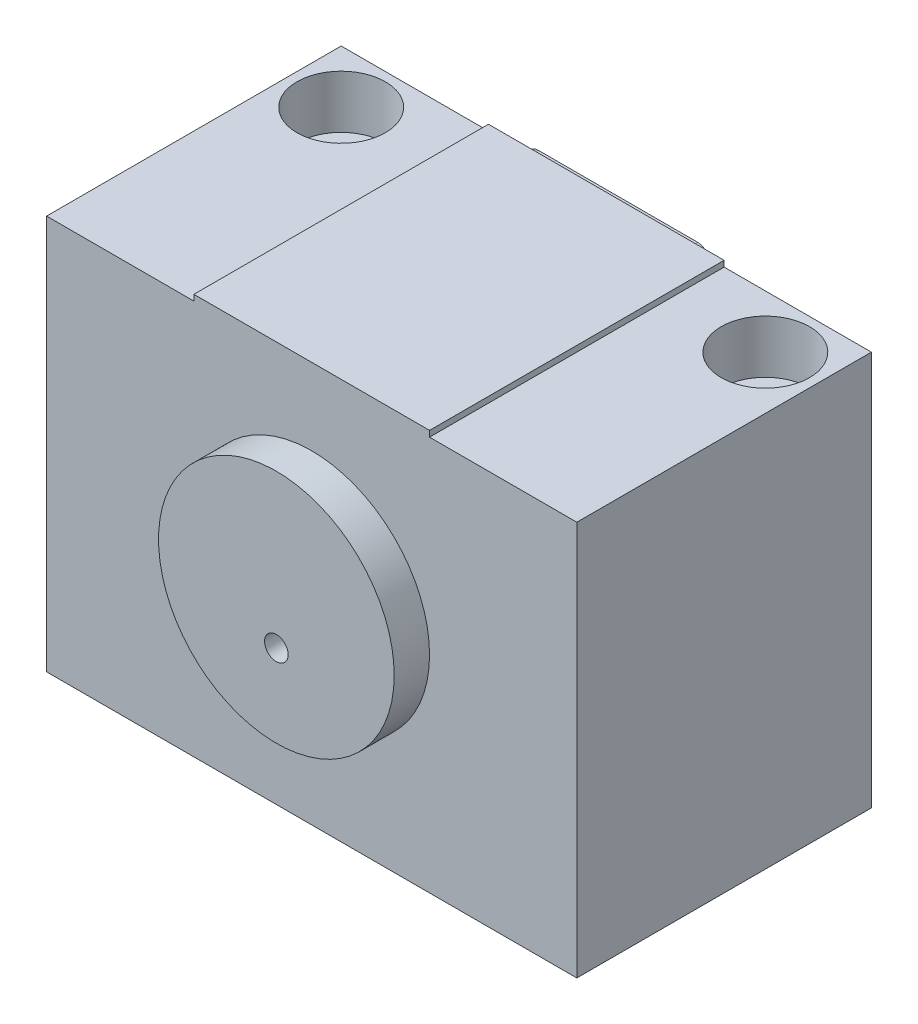
from build123d import *

# Parameters (mm, degrees)
SKETCH1_W                     = 45
SKETCH1_H                     = 33.5
BASE_EXTRUDE_DEPTH            = 25
SKETCH2_W                     = 20
SKETCH2_H                     = 0.5
TOPBOSS_DEPTH                 = 25
SKETCH3_R                     = 10
INSERT_DEPTH                  = 3
SKETCH5_R                     = 3.75
TOPCBORES_DEPTH               = 4.5
SKETCH6_R                     = 2.25
TOPTHRUHOLES_DEPTH            = 47.165463282
PORTTHRUHOLETOP_DEPTH         = 40.956226048
PORTTHRUHOLETOP_DEPTH_BACK    = 40.956226048
SKETCH18_R                    = 1
SKETCH24_R                    = 1
PORTTHRUHOLEBOTTOM_DEPTH      = 56.814424659
SKETCH25_R                    = 2.5
SIDEACBORETOP_DEPTH           = 5
SIDEBCBORETOP_START           = -5
SKETCH26_R                    = 2.5
SIDEBCBORETOP_DEPTH           = 5
SKETCH28_R                    = 2.5
SIDEACBOREBOTTOM_DEPTH        = 5
SIDEBCBOREBOTTOM_START        = -5
SKETCH29_R                    = 2.5
SIDEBCBOREBOTTOM_DEPTH        = 5
SKETCH19_R                    = 2.5
CVALVECUT2_DEPTH              = 2
SKETCH30_R                    = 2
CVALVE2_DEPTH                 = 2
SKETCH20_R                    = 2.5
EXTRUDE_1_DEPTH               = 4
SKETCH21_R                    = 2.5
EXTRUDE_2_DEPTH               = 4
SKETCH35_R                    = 2.5
CENTERENDPORTH_R_G_DEPTH      = 5
SKETCH36_R                    = 1
CENTERENDPORTH_R_G_THRU_DEPTH = 37.626493144
SKETCH37_R                    = 2.5
OFFCENTERENDPORTH_R_DEPTH     = 5
SKETCH38_R                    = 1
OFFCENTERENDPORTH_RTHRU_DEPTH = 5
PLASTICCAP_DEPTH              = 1
SKETCH40_R                    = 2.5
BOTTOMPORTS_DEPTH             = 5
SKETCH41_R                    = 1
BOTTOMAPASSAGE_DEPTH          = 22.5
SKETCH42_R                    = 1
BOTTOMBPASSAGE_DEPTH          = 11.5
SKETCH43_R                    = 3
CUT_EXTRUDE1_DEPTH            = 12


with BuildPart() as part:
    # Sketch1 → Base-Extrude (new body)
    with BuildSketch(Plane.XY):
        with Locations((0, -0.75)):
            Rectangle(SKETCH1_W, SKETCH1_H)
    extrude(amount=BASE_EXTRUDE_DEPTH)

    # Sketch2 → TopBoss (add)
    with BuildSketch(Plane.XY):
        with Locations((0, 16.25)):
            Rectangle(SKETCH2_W, SKETCH2_H)
    extrude(amount=TOPBOSS_DEPTH)

    # Sketch3 → Insert (add)
    with BuildSketch(Plane.XY.offset(25)):
        Circle(SKETCH3_R)
    extrude(amount=INSERT_DEPTH)

    # Sketch5 → TopCbores (cut)
    with BuildSketch(Plane(origin=(0, 16, 0), x_dir=(-1, 0, 0), z_dir=(0, 1, 0))):
        with Locations(Location((18, 4.5, 0), (0, 0, 90))):
            Circle(SKETCH5_R)
        with Locations(Location((-18, 4.5, 0), (0, 0, 270))):
            Circle(SKETCH5_R)
    extrude(amount=-TOPCBORES_DEPTH, mode=Mode.SUBTRACT)

    # Sketch6 → TopThruHoles (cut, through all)
    with BuildSketch(Plane(origin=(0, 11.5, 0), x_dir=(-1, 0, 0), z_dir=(0, 1, 0))):
        with Locations(Location((-18, 4.5, 0), (0, 0, 90))):
            Circle(SKETCH6_R)
        with Locations(Location((18, 4.5, 0), (0, 0, 90))):
            Circle(SKETCH6_R)
    extrude(amount=-TOPTHRUHOLES_DEPTH, mode=Mode.SUBTRACT)

    # Sketch18 → PortThruHoleTop (cut, two sides: drawn at the far end of the back side and taken through both)
    with BuildSketch(Plane(origin=(0, 0, 0), x_dir=(0, 0, -1), z_dir=(1, 0, 0)).offset(-PORTTHRUHOLETOP_DEPTH_BACK)):
        with Locations((-12.5, 5)):
            Circle(SKETCH18_R)
    extrude(amount=PORTTHRUHOLETOP_DEPTH + PORTTHRUHOLETOP_DEPTH_BACK, mode=Mode.SUBTRACT)

    # Sketch24 → PortThruHoleBottom (cut, through all)
    with BuildSketch(Plane(origin=(22.5, 0, 0), x_dir=(0, 0, -1), z_dir=(1, 0, 0))):
        with Locations(Location((-12.5, -6, 0), (0, 0, 90))):
            Circle(SKETCH24_R)
    extrude(amount=-PORTTHRUHOLEBOTTOM_DEPTH, mode=Mode.SUBTRACT)

    # Sketch25 → SideACboreTop (cut)
    with BuildSketch(Plane(origin=(22.5, 0, 0), x_dir=(0, 0, -1), z_dir=(1, 0, 0))):
        with Locations(Location((-12.5, 5, 0), (0, 0, 90))):
            Circle(SKETCH25_R)
    extrude(amount=-SIDEACBORETOP_DEPTH, mode=Mode.SUBTRACT)

    # Sketch26 → SideBCboreTop (cut)
    with BuildSketch(Plane.ZY.offset(22.5).offset(SIDEBCBORETOP_START)):
        with Locations(Location((12.5, 5, 0), (0, 0, 90))):
            Circle(SKETCH26_R)
    extrude(amount=SIDEBCBORETOP_DEPTH, mode=Mode.SUBTRACT)

    # Sketch28 → SideACboreBottom (cut)
    with BuildSketch(Plane(origin=(22.5, 0, 0), x_dir=(0, 0, -1), z_dir=(1, 0, 0))):
        with Locations(Location((-12.5, -6, 0), (0, 0, 90))):
            Circle(SKETCH28_R)
    extrude(amount=-SIDEACBOREBOTTOM_DEPTH, mode=Mode.SUBTRACT)

    # Sketch29 → SideBCboreBottom (cut)
    with BuildSketch(Plane.ZY.offset(22.5).offset(SIDEBCBOREBOTTOM_START)):
        with Locations(Location((12.5, -6, 0), (0, 0, 90))):
            Circle(SKETCH29_R)
    extrude(amount=SIDEBCBOREBOTTOM_DEPTH, mode=Mode.SUBTRACT)

    # Sketch19 → CValveCut2 (cut)
    with BuildSketch(Plane.ZY.offset(22.5)):
        with Locations(Location((17.5, 0, 0), (0, 0, 270))):
            Circle(SKETCH19_R)
    extrude(amount=-CVALVECUT2_DEPTH, mode=Mode.SUBTRACT)

    # Sketch30 → CValve2 (add)
    with BuildSketch(Plane.ZY.offset(20.5)):
        with Locations(Location((17.5, 0, 0), (0, 0, 90))):
            Circle(SKETCH30_R)
    extrude(amount=CVALVE2_DEPTH)

    # Sketch20 → 1 (add)
    with BuildSketch(Plane(origin=(22.5, 0, 0), x_dir=(0, 0, -1), z_dir=(1, 0, 0))):
        with Locations(Location((-12.5, 5, 0), (0, 0, 90))):
            Circle(SKETCH20_R)
    extrude(amount=-EXTRUDE_1_DEPTH)

    # Sketch21 → 2 (add)
    with BuildSketch(Plane(origin=(22.5, 0, 0), x_dir=(0, 0, -1), z_dir=(1, 0, 0))):
        with Locations(Location((-12.5, -6, 0), (0, 0, 90))):
            Circle(SKETCH21_R)
    extrude(amount=-EXTRUDE_2_DEPTH)

    # Sketch35 → CenterEndPortH&R_G (cut)
    with BuildSketch(Plane(origin=(0, 0, 0), x_dir=(-1, 0, 0), z_dir=(0, 0, -1))):
        with Locations((0, -3)):
            Circle(SKETCH35_R)
    extrude(amount=-CENTERENDPORTH_R_G_DEPTH, mode=Mode.SUBTRACT)

    # Sketch36 → CenterEndPortH&R_G_Thru (cut, through all)
    with BuildSketch(Plane(origin=(0, 0, 5), x_dir=(-1, 0, 0), z_dir=(0, 0, -1))):
        with Locations((0, -3)):
            Circle(SKETCH36_R)
    extrude(amount=-CENTERENDPORTH_R_G_THRU_DEPTH, mode=Mode.SUBTRACT)

    # Sketch37 → OffCenterEndPortH&R (cut)
    with BuildSketch(Plane(origin=(0, 0, 0), x_dir=(-1, 0, 0), z_dir=(0, 0, -1))):
        with Locations((12, 2)):
            Circle(SKETCH37_R)
    extrude(amount=-OFFCENTERENDPORTH_R_DEPTH, mode=Mode.SUBTRACT)

    # Sketch38 → OffCenterEndPortH&RThru (cut)
    with BuildSketch(Plane(origin=(0, 0, 5), x_dir=(-1, 0, 0), z_dir=(0, 0, -1))):
        with Locations((12, 2)):
            Circle(SKETCH38_R)
    extrude(amount=-OFFCENTERENDPORTH_RTHRU_DEPTH, mode=Mode.SUBTRACT)

    # Sketch39 → PlasticCap (add)
    with BuildSketch(Plane(origin=(0, 0, 0), x_dir=(-1, 0, 0), z_dir=(0, 0, -1))):
        with BuildLine():
            Line((-6.75, 15.7), (6.75, 15.7))
            ThreePointArc((6.75, 15.7), (7.457106781, 15.407106781), (7.75, 14.7))
            Line((7.75, 14.7), (7.75, 13.2))
            Line((7.75, 13.2), (5.151923789, 8.7))
            Line((5.151923789, 8.7), (-5.151923789, 8.7))
            Line((-5.151923789, 8.7), (-7.75, 13.2))
            Line((-7.75, 13.2), (-7.75, 14.7))
            ThreePointArc((-7.75, 14.7), (-7.457106781, 15.407106781), (-6.75, 15.7))
        make_face()
    extrude(amount=PLASTICCAP_DEPTH)

    # Sketch40 → BottomPorts (cut)
    with BuildSketch(Plane.XZ.offset(17.5)):
        with Locations(Location((12, 12.5, 0), (0, 0, 270))):
            Circle(SKETCH40_R)
        with Locations(Location((-12, 12.5, 0), (0, 0, 270))):
            Circle(SKETCH40_R)
    extrude(amount=-BOTTOMPORTS_DEPTH, mode=Mode.SUBTRACT)

    # Sketch41 → BottomAPassage (cut)
    with BuildSketch(Plane.XZ.offset(17.5)):
        with Locations(Location((12, 12.5, 0), (0, 0, 270))):
            Circle(SKETCH41_R)
    extrude(amount=-BOTTOMAPASSAGE_DEPTH, mode=Mode.SUBTRACT)

    # Sketch42 → BottomBPassage (cut)
    with BuildSketch(Plane.XZ.offset(17.5)):
        with Locations(Location((-12, 12.5, 0), (0, 0, 270))):
            Circle(SKETCH42_R)
    extrude(amount=-BOTTOMBPASSAGE_DEPTH, mode=Mode.SUBTRACT)

    # Sketch43 → Cut-Extrude1 (cut)
    with BuildSketch(Plane.XZ.offset(17.5)):
        with Locations((-18, 4.5)):
            Circle(SKETCH43_R)
        with Locations((18, 4.5)):
            Circle(SKETCH43_R)
    extrude(amount=-CUT_EXTRUDE1_DEPTH, mode=Mode.SUBTRACT)


solid = part.part
